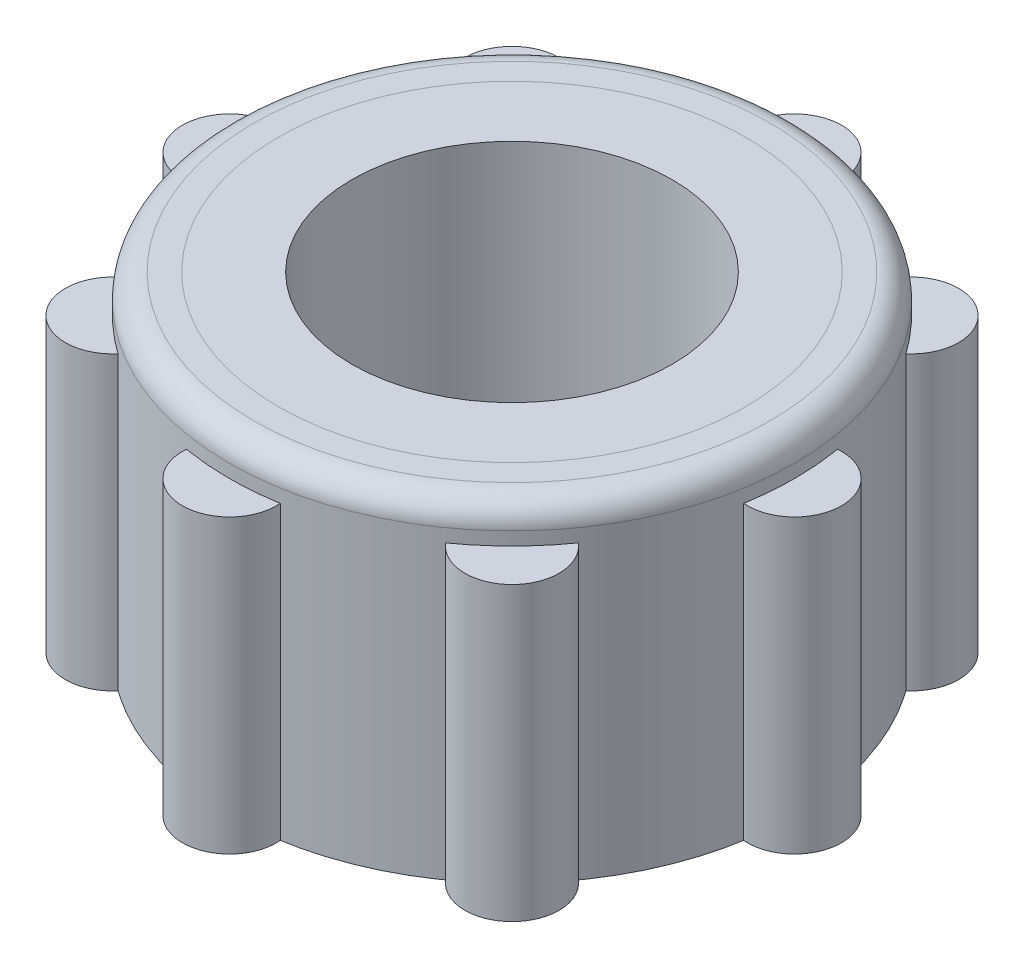
from build123d import *

# Parameters (mm, degrees)
SKETCH2_R             = 24.8
BOSS_EXTRUDE1_DEPTH   = 35
BOSS_EXTRUDE2_DEPTH   = 31
BOSS_EXTRUDE2_2_DEPTH = 31
BOSS_EXTRUDE2_3_DEPTH = 31
BOSS_EXTRUDE2_4_DEPTH = 31
BOSS_EXTRUDE2_5_DEPTH = 31
BOSS_EXTRUDE2_6_DEPTH = 31
BOSS_EXTRUDE2_7_DEPTH = 31
BOSS_EXTRUDE2_8_DEPTH = 31
SKETCH2_11_R          = 24.8
SKETCH2_11_R_2        = 17
BOSS_EXTRUDE4_DEPTH   = 35
FILLET5_R             = 2.6


with BuildPart() as part:
    # Sketch2 → Boss-Extrude1 (new body)
    with BuildSketch(Plane(origin=(0, 0, 0), x_dir=(1, 0, 0), z_dir=(0, 1, 0))):
        with BuildLine():
            ThreePointArc((29.58333333333338, -4.982608642958634), (29.895651857753503, -2.4999999999998614), (29.999999999999996, -7.35e-15))
            ThreePointArc((29.999999999999996, 0), (29.895651857753478, 2.5000000000001705), (29.58333333333327, 4.982608642959254))
            ThreePointArc((29.58333333333327, 4.982608642959254), (27.71638597533855, 11.480502970952813), (24.441811969537028, 17.39533925066701))
            ThreePointArc((24.441811969537028, 17.39533925066701), (21.213203435596466, 21.21320343559638), (17.395339250667107, 24.44181196953696))
            ThreePointArc((17.395339250667107, 24.44181196953696), (11.480502970952717, 27.71638597533859), (4.982608642958938, 29.583333333333325))
            ThreePointArc((4.982608642958938, 29.583333333333325), (1.84e-15, 29.999999999999996), (-4.98260864295894, 29.583333333333325))
            ThreePointArc((-4.98260864295894, 29.583333333333325), (-11.480502970952713, 27.71638597533859), (-17.395339250667096, 24.441811969536968))
            ThreePointArc((-17.395339250667096, 24.441811969536968), (-21.21320343559646, 21.213203435596387), (-24.441811969537017, 17.395339250667025))
            ThreePointArc((-24.441811969537017, 17.395339250667025), (-27.71638597533862, 11.480502970952633), (-29.583333333333343, 4.982608642958841))
            ThreePointArc((-29.583333333333343, 4.982608642958841), (-29.999999999999996, -1.0291e-13), (-29.583333333333307, -4.982608642959043))
            ThreePointArc((-29.583333333333307, -4.982608642959043), (-27.716385975338632, -11.480502970952614), (-24.441811969537152, -17.395339250666837))
            ThreePointArc((-24.441811969537152, -17.395339250666837), (-21.213203435596615, -21.21320343559623), (-17.395339250667277, -24.441811969536836))
            ThreePointArc((-17.395339250667277, -24.441811969536836), (-11.480502970953104, -27.71638597533843), (-4.9826086429595255, -29.58333333333323))
            ThreePointArc((-4.9826086429595255, -29.58333333333323), (-2.1867e-13, -29.999999999999996), (4.9826086429591205, -29.583333333333293))
            ThreePointArc((4.9826086429591205, -29.583333333333293), (11.4805029709527, -27.716385975338596), (17.395339250666918, -24.44181196953709))
            ThreePointArc((17.395339250666918, -24.44181196953709), (21.213203435596306, -21.21320343559654), (24.441811969536896, -17.395339250667192))
            ThreePointArc((24.441811969536896, -17.395339250667192), (27.716385975338632, -11.480502970952612), (29.58333333333338, -4.982608642958634))
        make_face()
        Circle(SKETCH2_R, mode=Mode.SUBTRACT)
    extrude(amount=BOSS_EXTRUDE1_DEPTH)

    # Fillet5
    fillet5_edges = [part.edges().sort_by_distance(p)[0] for p in [
        (-29.58333333333346, 35, -4.982608642958666),
    ]]
    fillet(fillet5_edges, radius=FILLET5_R)


with BuildPart() as body_2:
    # Sketch2<8> → Boss-Extrude2 (new body)
    with BuildSketch(Plane(origin=(0, 0, 0), x_dir=(1, 0, 0), z_dir=(0, 1, 0))):
        with BuildLine():
            ThreePointArc((29.583333333333275, 4.982608642959254), (30, 3.1974e-13), (29.583333333333382, -4.982608642958624))
            ThreePointArc((29.58333333333338, -4.982608642958625), (34.999999999997485, 3.6798e-13), (29.583333333333282, 4.982608642959255))
        make_face()
    extrude(amount=BOSS_EXTRUDE2_DEPTH)


with BuildPart() as body_3:
    # Sketch2<8> → Boss-Extrude2 2 (new body)
    with BuildSketch(Plane(origin=(0, 0, 0), x_dir=(1, 0, 0), z_dir=(0, 1, 0))):
        with BuildLine():
            ThreePointArc((17.395339250667107, 24.44181196953696), (21.213203435596466, 21.21320343559638), (24.441811969537028, 17.39533925066701))
            ThreePointArc((24.44181196953703, 17.39533925066701), (24.74873734152867, 24.74873734152857), (17.39533925066711, 24.441811969536964))
        make_face()
    extrude(amount=BOSS_EXTRUDE2_2_DEPTH)


with BuildPart() as body_4:
    # Sketch2<8> → Boss-Extrude2 3 (new body)
    with BuildSketch(Plane(origin=(0, 0, 0), x_dir=(1, 0, 0), z_dir=(0, 1, 0))):
        with BuildLine():
            ThreePointArc((17.395339250666932, -24.441811969537085), (24.748737341529054, -24.748737341529317), (24.441811969536907, -17.39533925066719))
            ThreePointArc((24.441811969536896, -17.395339250667192), (21.213203435596306, -21.21320343559654), (17.395339250666918, -24.44181196953709))
        make_face()
    extrude(amount=BOSS_EXTRUDE2_3_DEPTH)


with BuildPart() as body_5:
    # Sketch2<8> → Boss-Extrude2 4 (new body)
    with BuildSketch(Plane(origin=(0, 0, 0), x_dir=(1, 0, 0), z_dir=(0, 1, 0))):
        with BuildLine():
            ThreePointArc((-4.98260864295894, 29.583333333333325), (1.84e-15, 29.999999999999996), (4.982608642958938, 29.583333333333325))
            ThreePointArc((4.98260864295894, 29.58333333333333), (9.4e-16, 35.000000000000014), (-4.982608642958942, 29.583333333333332))
        make_face()
    extrude(amount=BOSS_EXTRUDE2_4_DEPTH)


with BuildPart() as body_6:
    # Sketch2<8> → Boss-Extrude2 5 (new body)
    with BuildSketch(Plane(origin=(0, 0, 0), x_dir=(1, 0, 0), z_dir=(0, 1, 0))):
        with BuildLine():
            ThreePointArc((-4.982608642959509, -29.583333333333233), (-2.281e-13, -35.000000000009365), (4.982608642959123, -29.583333333333297))
            ThreePointArc((4.9826086429591205, -29.583333333333293), (-2.1867e-13, -29.999999999999996), (-4.9826086429595255, -29.58333333333323))
        make_face()
    extrude(amount=BOSS_EXTRUDE2_5_DEPTH)


with BuildPart() as body_7:
    # Sketch2<8> → Boss-Extrude2 6 (new body)
    with BuildSketch(Plane(origin=(0, 0, 0), x_dir=(1, 0, 0), z_dir=(0, 1, 0))):
        with BuildLine():
            ThreePointArc((-24.441811969537017, 17.395339250667025), (-21.21320343559646, 21.213203435596387), (-17.395339250667096, 24.441811969536968))
            ThreePointArc((-17.3953392506671, 24.441811969536964), (-24.74873734152922, 24.74873734152914), (-24.441811969537024, 17.39533925066702))
        make_face()
    extrude(amount=BOSS_EXTRUDE2_6_DEPTH)


with BuildPart() as body_8:
    # Sketch2<8> → Boss-Extrude2 7 (new body)
    with BuildSketch(Plane(origin=(0, 0, 0), x_dir=(1, 0, 0), z_dir=(0, 1, 0))):
        with BuildLine():
            ThreePointArc((-24.44181196953715, -17.395339250666844), (-24.748737341529395, -24.748737341528958), (-17.395339250667277, -24.441811969536843))
            ThreePointArc((-17.395339250667277, -24.441811969536836), (-21.213203435596615, -21.21320343559623), (-24.441811969537152, -17.395339250666837))
        make_face()
    extrude(amount=BOSS_EXTRUDE2_7_DEPTH)


with BuildPart() as body_9:
    # Sketch2<8> → Boss-Extrude2 8 (new body)
    with BuildSketch(Plane(origin=(0, 0, 0), x_dir=(1, 0, 0), z_dir=(0, 1, 0))):
        with BuildLine():
            ThreePointArc((-29.583333333333307, -4.982608642959043), (-29.999999999999996, -1.0291e-13), (-29.583333333333343, 4.982608642958841))
            ThreePointArc((-29.58333333333334, 4.982608642958835), (-35.00000000000002, -1.199e-13), (-29.58333333333331, -4.982608642959043))
        make_face()
    extrude(amount=BOSS_EXTRUDE2_8_DEPTH)


with BuildPart() as body_10:
    # Sketch2<11> → Boss-Extrude4 (new body)
    with BuildSketch(Plane(origin=(0, 0, 0), x_dir=(1, 0, 0), z_dir=(0, 1, 0))):
        Circle(SKETCH2_11_R)
        Circle(SKETCH2_11_R_2, mode=Mode.SUBTRACT)
    extrude(amount=BOSS_EXTRUDE4_DEPTH)


solid = Compound([part.part, body_2.part, body_3.part, body_4.part, body_5.part, body_6.part, body_7.part, body_8.part, body_9.part, body_10.part])
